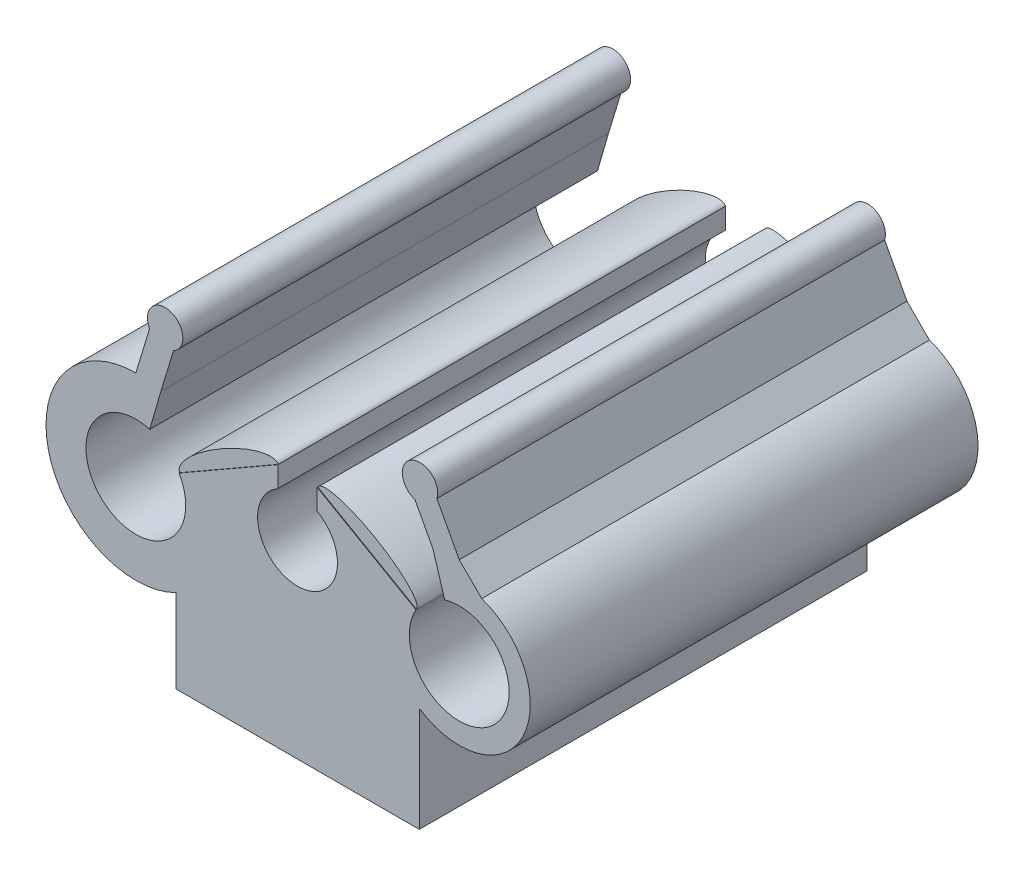
from build123d import *

# Parameters (mm, degrees)
Y_KSEKLIK_EKSTR_ZYON1_DEPTH = 22.43
Y_KSEKLIK_EKSTR_ZYON3_DEPTH = 22.4
KES_EKSTR_ZYON3_DEPTH       = 22.5


with BuildPart() as part:
    # Çizim1 → Yükseklik-Ekstrüzyon1 (new body)
    with BuildSketch(Plane.XY):
        with BuildLine():
            Line((0, 4.168871126), (0, 0))
            Line((0, 0), (12.2, 0))
            Line((12.2, 0), (12.2, 4.168871126))
            ThreePointArc((12.2, 4.168871126), (18.58121444, 7.172887527), (14.2, 12.7))
            Line((14.2, 12.7), (13.080916647, 14.793032346))
            ThreePointArc((13.080916647, 14.793032346), (11.817033945, 15.831345203), (11.978588262, 14.203649507))
            Line((11.978588262, 14.203649507), (12.887207184, 12.504250808))
            Line((12.887207184, 12.504250808), (13.470670658, 10.591250449))
            ThreePointArc((13.470670658, 10.591250449), (15.758549535, 6.245281773), (12.031216834, 9.443535113))
            Line((12.031216834, 9.443535113), (10.2961903, 10.438363203))
            Line((10.2961903, 10.438363203), (7.999890113, 11.755013921))
            Line((7.999890113, 11.755013921), (7.086391214, 12.27879517))
            Line((7.086391214, 12.27879517), (7.086391214, 11.239836881))
            ThreePointArc((7.086391214, 11.239836881), (7.828117824, 10.506781399), (8.1, 9.5))
            ThreePointArc((8.1, 9.5), (5.093218601, 7.771882176), (5.113608786, 11.239836881))
            Line((5.113608786, 11.239836881), (5.113608786, 12.27879517))
            Line((5.113608786, 12.27879517), (4.200109887, 11.755013921))
            Line((4.200109887, 11.755013921), (1.9038097, 10.438363203))
            Line((1.9038097, 10.438363203), (0.168783166, 9.443535113))
            ThreePointArc((0.168783166, 9.443535113), (-3.544803783, 6.234400531), (-1.304278774, 10.601243839))
            Line((-1.304278774, 10.601243839), (-0.747701793, 12.522238911))
            Line((-0.747701793, 12.522238911), (-0.115093584, 14.608601518))
            ThreePointArc((-0.115093584, 14.608601518), (-0.274595552, 16.23649961), (-1.311314062, 14.971308793))
            Line((-1.311314062, 14.971308793), (-2, 12.7))
            ThreePointArc((-2, 12.7), (-6.38121444, 7.172887527), (0, 4.168871126))
        make_face()
    extrude(amount=Y_KSEKLIK_EKSTR_ZYON1_DEPTH)

    # Çizim2 → Yükseklik-Ekstrüzyon3 (add)
    with BuildSketch(Plane(origin=(0, 0, 0), x_dir=(-1, 0, 0), z_dir=(0, 0, -1))):
        with BuildLine():
            Line((-12.031216834, 9.443535113), (-7.086391214, 12.27879517))
            add(Edge.make_bspline(
                [(-7.086391214, 12.27879517), (-7.47040591, 12.948534689), (-9.94281872, 11.53090466), (-12.41523153, 10.113274632), (-12.031216834, 9.443535113)],
                knots=[3.141592654, 3.141592654, 3.141592654, 4.71238898, 4.71238898, 6.283185307, 6.283185307, 6.283185307], degree=2, weights=[1, 0.707106781, 1, 0.707106781, 1]))
        make_face()
        with BuildLine():
            Line((-5.113608786, 12.27879517), (-0.168783166, 9.443535113))
            add(Edge.make_bspline(
                [(-0.168783166, 9.443535113), (0.214205175, 10.111484622), (-2.258207635, 11.529114651), (-4.730620444, 12.946744679), (-5.113608786, 12.27879517)],
                knots=[0, 0, 0, 1.570796327, 1.570796327, 3.141592654, 3.141592654, 3.141592654], degree=2, weights=[1, 0.707106781, 1, 0.707106781, 1]))
        make_face()
    extrude(amount=-Y_KSEKLIK_EKSTR_ZYON3_DEPTH)

    # Çizim3 → Kes-Ekstrüzyon3 (cut)
    with BuildSketch(Plane(origin=(0, 0, 0), x_dir=(-1, 0, 0), z_dir=(0, 0, -1))):
        with BuildLine():
            Line((-12.2, 5.257722025), (-12.2, 4.168871126))
            ThreePointArc((-12.2, 4.168871126), (-18.58121444, 7.172887527), (-14.2, 12.7))
            Line((-14.2, 12.7), (-15.324833416, 11.575166584))
            ThreePointArc((-15.324833416, 11.575166584), (-17.388887828, 6.622662336), (-12.2, 5.257722025))
        make_face()
    extrude(amount=-KES_EKSTR_ZYON3_DEPTH, mode=Mode.SUBTRACT)


solid = part.part
